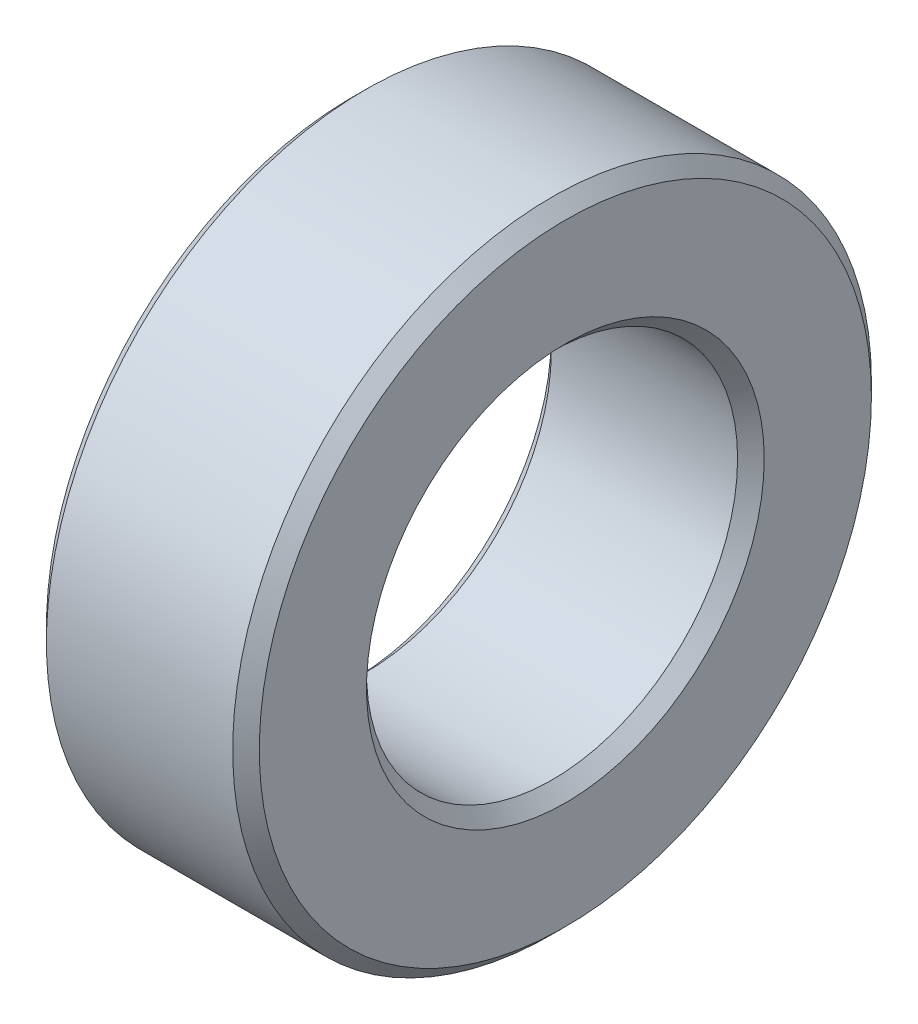
from build123d import *

# Parameters (mm, degrees)
SKETCH1_R           = 6
SKETCH1_R_2         = 3.486
BOSS_EXTRUDE1_DEPTH = 4
CHAMFER1_SIZE       = 0.25


with BuildPart() as part:
    # Sketch1 → Boss-Extrude1 (new body)
    with BuildSketch(Plane(origin=(0, 0, 0), x_dir=(0, 0, -1), z_dir=(1, 0, 0))):
        Circle(SKETCH1_R)
        Circle(SKETCH1_R_2, mode=Mode.SUBTRACT)
    extrude(amount=BOSS_EXTRUDE1_DEPTH)

    # Chamfer1
    chamfer1_edges = [part.edges().sort_by_distance(p)[0] for p in [
        (0, 0, 6),
        (4, 0, 6),
        (0, 0, 3.486),
        (4, 0, 3.486),
    ]]
    chamfer(chamfer1_edges, length=CHAMFER1_SIZE)


solid = part.part
